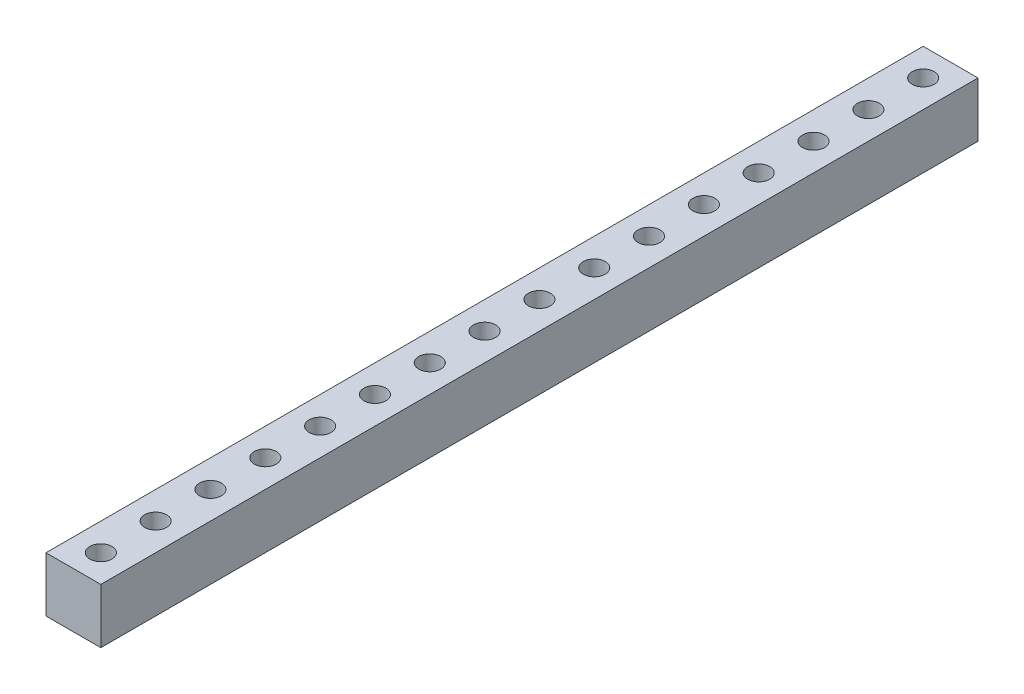
from build123d import *

# Parameters (mm, degrees)
SKETCH1_W             = 40.64
SKETCH1_H             = 2.54
BOSS_EXTRUDE1_DEPTH   = 2.54
F_1_0MM_DOWEL_HOLE1_D = 1.02
LPATTERN1_COUNT       = 16
LPATTERN1_PITCH       = 2.54


with BuildPart() as part:
    # Sketch1 → Boss-Extrude1 (new body)
    with BuildSketch(Plane(origin=(0, 0, 0), x_dir=(0, 0, -1), z_dir=(1, 0, 0))):
        Rectangle(SKETCH1_W, SKETCH1_H)
    extrude(amount=BOSS_EXTRUDE1_DEPTH)

    # Ø1.0mm Dowel Hole1 (through all)
    with Locations(Plane(origin=(1.27, 1.27, 19.05), x_dir=(0, 0, 1), z_dir=(0, 1, 0))):
        with Locations((0, 0)):
            f_1_0mm_dowel_hole1 = Hole(F_1_0MM_DOWEL_HOLE1_D / 2)

    # LPattern1: Ø1.0mm Dowel Hole1 ×16
    with Locations(*[(0, 0, -i * LPATTERN1_PITCH) for i in range(1, LPATTERN1_COUNT)]):
        add(f_1_0mm_dowel_hole1, mode=Mode.SUBTRACT)


solid = part.part
